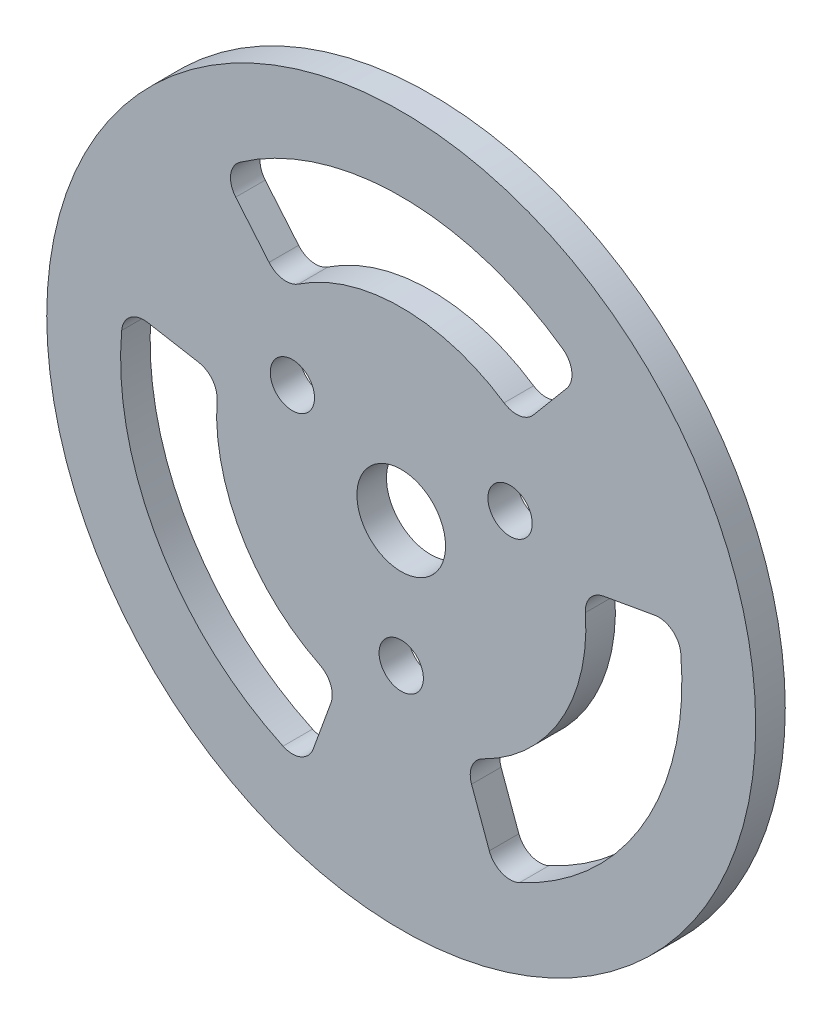
from build123d import *

# Parameters (mm, degrees)
SKETCH_1_R      = 24
SKETCH_1_R_2    = 3
SKETCH_1_R_3    = 1.5
EXTRUDE_1_DEPTH = 2
FILLET_1_R      = 1.5


with BuildPart() as part:
    # 草图1 → 凸台-拉伸1 (new body)
    with BuildSketch(Plane.XY):
        Circle(SKETCH_1_R)
        Circle(SKETCH_1_R_2, mode=Mode.SUBTRACT)
        with Locations((-7.368432559, 4.254166522)):
            Circle(SKETCH_1_R_3, mode=Mode.SUBTRACT)
        with Locations((7.368432559, 4.254166522)):
            Circle(SKETCH_1_R_3, mode=Mode.SUBTRACT)
        with Locations((0, -8.508333043)):
            Circle(SKETCH_1_R_3, mode=Mode.SUBTRACT)
        with BuildLine():
            Line((8.034845121, 9.575555539), (12.212964584, 14.554844419))
            ThreePointArc((12.212964584, 14.554844419), (0, 19), (-12.212964584, 14.554844419))
            Line((-12.212964584, 14.554844419), (-8.034845121, 9.575555539))
            ThreePointArc((-8.034845121, 9.575555539), (0, 12.5), (8.034845121, 9.575555539))
        make_face(mode=Mode.SUBTRACT)
        with BuildLine():
            Line((12.310096913, 2.170602221), (18.711347307, 3.299315376))
            ThreePointArc((18.711347307, 3.299315376), (16.454482672, -9.5), (6.498382723, -17.854159795))
            Line((6.498382723, -17.854159795), (4.275251792, -11.74615776))
            ThreePointArc((4.275251792, -11.74615776), (10.825317547, -6.25), (12.310096913, 2.170602221))
        make_face(mode=Mode.SUBTRACT)
        with BuildLine():
            Line((-4.275251792, -11.74615776), (-6.498382723, -17.854159795))
            ThreePointArc((-6.498382723, -17.854159795), (-16.454482672, -9.5), (-18.711347307, 3.299315376))
            Line((-18.711347307, 3.299315376), (-12.310096913, 2.170602221))
            ThreePointArc((-12.310096913, 2.170602221), (-10.825317547, -6.25), (-4.275251792, -11.74615776))
        make_face(mode=Mode.SUBTRACT)
    extrude(amount=EXTRUDE_1_DEPTH)

    # 圆角1
    fillet_1_edges = [part.edges().sort_by_distance(p)[0] for p in [
        (-8.034845121, 9.575555539, 1),
        (8.034845121, 9.575555539, 1),
        (12.212964584, 14.554844419, 1),
        (-12.212964584, 14.554844419, 1),
        (12.310096913, 2.170602221, 1),
        (4.275251792, -11.74615776, 1),
        (6.498382723, -17.854159795, 1),
        (18.711347307, 3.299315376, 1),
        (-4.275251792, -11.74615776, 1),
        (-12.310096913, 2.170602221, 1),
        (-18.711347307, 3.299315376, 1),
        (-6.498382723, -17.854159795, 1),
    ]]
    fillet(fillet_1_edges, radius=FILLET_1_R)


solid = part.part
